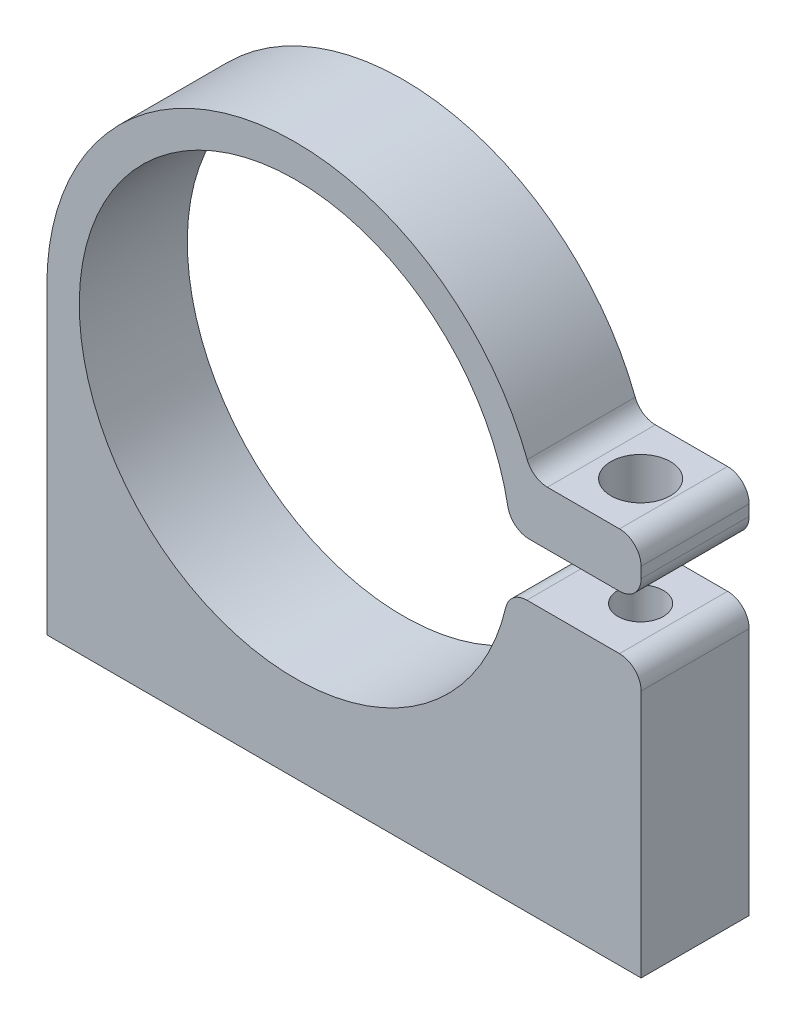
from build123d import *

# Parameters (mm, degrees)
EXTRUDE_1_DEPTH       = 10
FILLET_1_R            = 2
HOLE_WIZARD_M51_D     = 5.5
HOLE_WIZARD_M51_DEPTH = 5
M5X0_81_D             = 4.2
M5X0_82_D             = 4.2
M5X0_82_DEPTH         = 10
M5X0_82_TIP           = 1.2618073


with BuildPart() as part:
    # Эскиз1 → Бобышка-Вытянуть1 (new body)
    with BuildSketch(Plane.XY):
        with BuildLine():
            Line((32, -3), (19.773719933, -3))
            ThreePointArc((19.773719933, -3), (-19.993649721, 0.503955172), (19.899748742, 2))
            Line((19.899748742, 2), (32, 2))
            Line((32, 2), (32, 7))
            Line((32, 7), (21.9089023, 7))
            ThreePointArc((21.9089023, 7), (-3.54226249, 22.725588583), (-23, 0))
            Line((-23, 0), (-23, -28))
            Line((-23, -28), (32, -28))
            Line((32, -28), (32, -3))
        make_face()
    extrude(amount=EXTRUDE_1_DEPTH)

    # Скругление1
    fillet_1_edges = [part.edges().sort_by_distance(p)[0] for p in [
        (21.9089023, 7, 5),
        (32, 7, 5),
        (32, 2, 5),
        (19.899748742, 2, 5),
        (19.773719933, -3, 5),
        (32, -3, 5),
    ]]
    fillet(fillet_1_edges, radius=FILLET_1_R)

    # Отверстие с зазором M51
    with Locations(Plane(origin=(0, 7, 0), x_dir=(1, 0, 0), z_dir=(0, 1, 0))):
        with Locations((26.95445115, -5)):
            Hole(HOLE_WIZARD_M51_D / 2, depth=HOLE_WIZARD_M51_DEPTH)

    # Отверстие обработанное метчиком M5x0.81 (through all)
    with Locations(Plane(origin=(0, -3, 0), x_dir=(1, 0, 0), z_dir=(0, 1, 0))):
        with Locations((26.95445115, -5)):
            Hole(M5X0_81_D / 2)

    # Отверстие обработанное метчиком M5x0.82
    with Locations(Plane(origin=(0, -28, 0), x_dir=(-1, 0, 0), z_dir=(0, -1, 0))):
        with Locations((15, -5)):
            Hole(M5X0_82_D / 2, depth=M5X0_82_DEPTH)
            with Locations((0, 0, -(M5X0_82_DEPTH + M5X0_82_TIP / 2))):  # 118° drill point
                Cone(0, M5X0_82_D / 2, M5X0_82_TIP, mode=Mode.SUBTRACT)


solid = part.part
